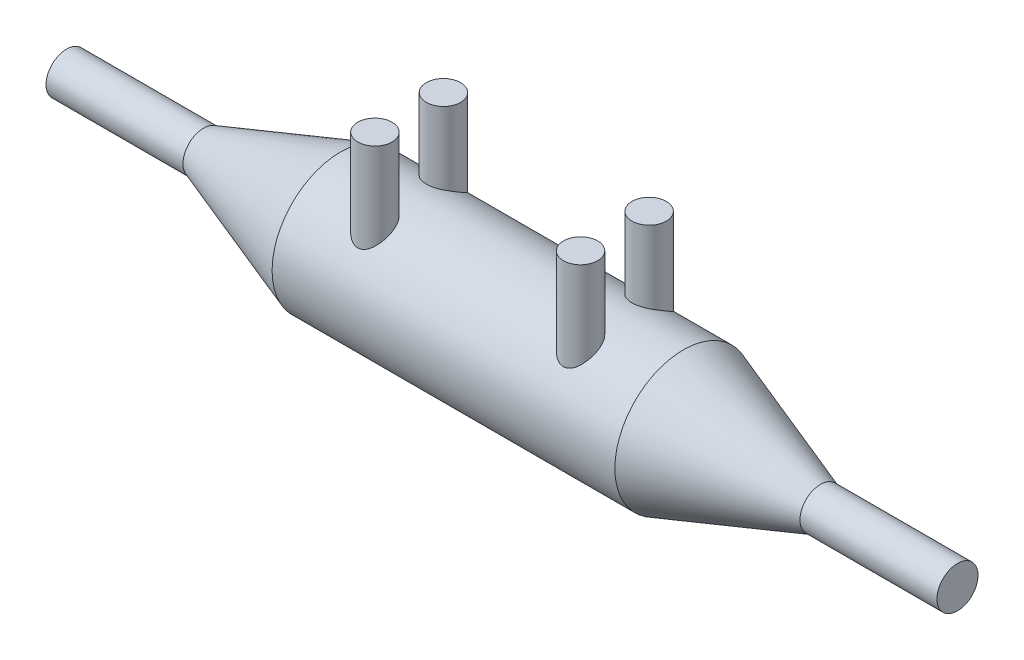
from build123d import *

# Parameters (mm, degrees)
ESQUISSE4_R          = 2.5
BOSS_EXTRU_2_DEPTH   = 20
BOSS_EXTRU_2_2_DEPTH = 20
BOSS_EXTRU_2_3_DEPTH = 20
BOSS_EXTRU_2_4_DEPTH = 20


with BuildPart() as part:
    # Esquisse3 → Révolution1 (revolve)
    with BuildSketch(Plane.XY, mode=Mode.PRIVATE) as r_volution1_sk:
        Polygon((-6.389000887, -3), (13.610999113, -10), (63.610999113, -10), (83.610999113, -3), (103.590246684, -3), (103.590246684, 0), (-26.368248458, 0), (-26.368248458, -3), align=None)
    revolve(r_volution1_sk.sketch.rotate(Axis((-30.076719088, 0, 0), (1, 0, 0)), 270), axis=Axis((-30.076719088, 0, 0), (1, 0, 0)))


with BuildPart() as body_2:
    # Esquisse4 → Boss.-Extru.2 (new body)
    with BuildSketch(Plane(origin=(0, 0, 0), x_dir=(1, 0, 0), z_dir=(0, 1, 0))):
        with Locations(Location((23.610999113, -5, 0), (0, 0, 270))):
            Circle(ESQUISSE4_R)
    extrude(amount=BOSS_EXTRU_2_DEPTH)


with BuildPart() as body_3:
    # Esquisse4 → Boss.-Extru.2 2 (new body)
    with BuildSketch(Plane(origin=(0, 0, 0), x_dir=(1, 0, 0), z_dir=(0, 1, 0))):
        with Locations(Location((53.610999113, -5, 0), (0, 0, 270))):
            Circle(ESQUISSE4_R)
    extrude(amount=BOSS_EXTRU_2_2_DEPTH)


with BuildPart() as body_4:
    # Esquisse4 → Boss.-Extru.2 3 (new body)
    with BuildSketch(Plane(origin=(0, 0, 0), x_dir=(1, 0, 0), z_dir=(0, 1, 0))):
        with Locations(Location((53.610999113, 5, 0), (0, 0, 90))):
            Circle(ESQUISSE4_R)
    extrude(amount=BOSS_EXTRU_2_3_DEPTH)


with BuildPart() as body_5:
    # Esquisse4 → Boss.-Extru.2 4 (new body)
    with BuildSketch(Plane(origin=(0, 0, 0), x_dir=(1, 0, 0), z_dir=(0, 1, 0))):
        with Locations(Location((23.610999113, 5, 0), (0, 0, 90))):
            Circle(ESQUISSE4_R)
    extrude(amount=BOSS_EXTRU_2_4_DEPTH)


solid = Compound([part.part, body_2.part, body_3.part, body_4.part, body_5.part])
